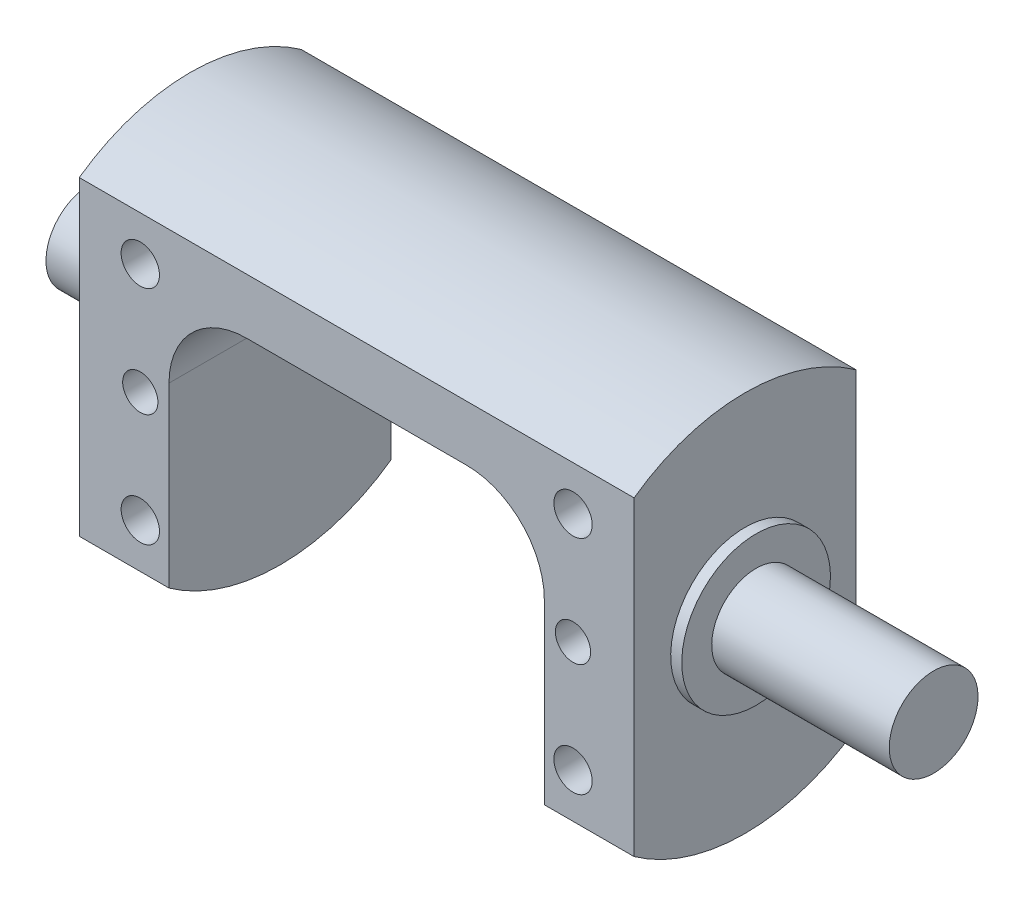
from build123d import *

# Parameters (mm, degrees)
CUT_EXTRUDE1_DEPTH                  = 72.281133549
CUT_EXTRUDE1_DEPTH_BACK             = 72.281133549
SKETCH3_OUTSIDE_W                   = 54.458
SKETCH3_OUTSIDE_H                   = 54.458
SKETCH3_OUTSIDE_W_2                 = 20
SKETCH3_OUTSIDE_H_2                 = 34.409301068
F_8_32_TAPPED_HOLE1_AT_2_COUNT      = 2
F_8_32_TAPPED_HOLE1_AT_2_PITCH      = 43.829214002
F_8_32_TAPPED_HOLE1_AT_3_COUNT      = 2
F_8_32_TAPPED_HOLE1_AT_3_PITCH      = 20
F_8_32_TAPPED_HOLE1_AT_4_COUNT      = 2
F_8_32_TAPPED_HOLE1_AT_4_PITCH      = 39
F_1_8_0_1250_DOWEL_HOLE1_AT_2_COUNT = 2
F_1_8_0_1250_DOWEL_HOLE1_AT_2_PITCH = 39
F_8_32_TAPPED_HOLE2_D               = 3.4544
F_8_32_TAPPED_HOLE2_DEPTH           = 10.71
F_8_32_TAPPED_HOLE2_TIP             = 1.037806461
CUT_EXTRUDE3_DEPTH                  = 50.598387071
CUT_EXTRUDE3_DEPTH_BACK             = 50.598387071


with BuildPart() as part:
    # Sketch2 → Revolve1 (revolve)
    with BuildSketch(Plane.XY, mode=Mode.PRIVATE) as revolve1_sk:
        Polygon((-34, 0), (42, 0), (42, 4), (26, 4), (26, 6.7), (25, 6.7), (25, 17.204650534), (-25, 17.204650534), (-25, 6.7), (-27.5, 6.7), (-27.5, 4), (-34, 4), align=None)
    revolve(revolve1_sk.sketch.rotate(Axis((-34, 0, 0), (1, 0, 0)), 180), axis=Axis((-34, 0, 0), (1, 0, 0)))

    # Sketch3 outside → Cut-Extrude1 (cut, two sides: drawn at the far end of the back side and taken through both)
    with BuildSketch(Plane.ZY.offset(25).offset(-CUT_EXTRUDE1_DEPTH_BACK)):
        Rectangle(SKETCH3_OUTSIDE_W, SKETCH3_OUTSIDE_H)
        Rectangle(SKETCH3_OUTSIDE_W_2, SKETCH3_OUTSIDE_H_2, mode=Mode.SUBTRACT)
    extrude(amount=CUT_EXTRUDE1_DEPTH + CUT_EXTRUDE1_DEPTH_BACK, mode=Mode.SUBTRACT)

    # Sketch5 → #8-32 Tapped Hole1 (revolve, cut)
    with BuildSketch(Plane(origin=(19.5, 10, -10), x_dir=(0, 1, 0), z_dir=(1, 0, 0))):
        Polygon((0, 0), (0, 11.747806461), (1.7272, 10.71), (1.7272, 0), align=None)
    f_8_32_tapped_hole1 = revolve(axis=Axis((19.5, 10, -16.35), (0, 0, 1)), mode=Mode.SUBTRACT)

    # #8-32 Tapped Hole1 at 2: #8-32 Tapped Hole1 ×2
    with Locations(*[Vector(-0.889817462812737, -0.4563166475962754, 0) * (i * F_8_32_TAPPED_HOLE1_AT_2_PITCH) for i in range(1, F_8_32_TAPPED_HOLE1_AT_2_COUNT)]):
        add(f_8_32_tapped_hole1, mode=Mode.SUBTRACT)

    # #8-32 Tapped Hole1 at 3: #8-32 Tapped Hole1 ×2
    with Locations(*[(0, -i * F_8_32_TAPPED_HOLE1_AT_3_PITCH, 0) for i in range(1, F_8_32_TAPPED_HOLE1_AT_3_COUNT)]):
        add(f_8_32_tapped_hole1, mode=Mode.SUBTRACT)

    # #8-32 Tapped Hole1 at 4: #8-32 Tapped Hole1 ×2
    with Locations(*[(-i * F_8_32_TAPPED_HOLE1_AT_4_PITCH, 0, 0) for i in range(1, F_8_32_TAPPED_HOLE1_AT_4_COUNT)]):
        add(f_8_32_tapped_hole1, mode=Mode.SUBTRACT)

    # Sketch7 → 1/8 (0.1250) Dowel Hole1 (revolve, cut)
    with BuildSketch(Plane(origin=(19.5, 0, -10), x_dir=(0, 1, 0), z_dir=(1, 0, 0))):
        Polygon((0, 0), (0, 6.953866233), (1.5875, 6), (1.5875, 0), align=None)
    f_1_8_0_1250_dowel_hole1 = revolve(axis=Axis((19.5, 0, -16.35), (0, 0, 1)), mode=Mode.SUBTRACT)

    # 1/8 (0.1250) Dowel Hole1 at 2: 1/8 (0.1250) Dowel Hole1 ×2
    with Locations(*[(-i * F_1_8_0_1250_DOWEL_HOLE1_AT_2_PITCH, 0, 0) for i in range(1, F_1_8_0_1250_DOWEL_HOLE1_AT_2_COUNT)]):
        add(f_1_8_0_1250_dowel_hole1, mode=Mode.SUBTRACT)

    # Mirror1: #8-32 Tapped Hole1, 1/8 (0.1250) Dowel Hole1 across plane
    add(f_8_32_tapped_hole1.mirror(Plane.XY), mode=Mode.SUBTRACT)
    add(f_1_8_0_1250_dowel_hole1.mirror(Plane.XY), mode=Mode.SUBTRACT)

    # Mirror1 copy 1 sketch → Mirror1 copy 1 (revolve, cut)
    with BuildSketch(Plane(origin=(-19.5, -10, 10), x_dir=(0, 1, 0), z_dir=(1, 0, 0))):
        Polygon((0, 0), (0, -11.747806461), (1.7272, -10.71), (1.7272, 0), align=None)
    revolve(axis=Axis((-19.5, -10, 16.35), (0, 0, 1)), mode=Mode.SUBTRACT)

    # Mirror1 copy 2 sketch → Mirror1 copy 2 (revolve, cut)
    with BuildSketch(Plane(origin=(19.5, -10, 10), x_dir=(0, 1, 0), z_dir=(1, 0, 0))):
        Polygon((0, 0), (0, -11.747806461), (1.7272, -10.71), (1.7272, 0), align=None)
    revolve(axis=Axis((19.5, -10, 16.35), (0, 0, 1)), mode=Mode.SUBTRACT)

    # Mirror1 copy 3 sketch → Mirror1 copy 3 (revolve, cut)
    with BuildSketch(Plane(origin=(-19.5, 10, 10), x_dir=(0, 1, 0), z_dir=(1, 0, 0))):
        Polygon((0, 0), (0, -11.747806461), (1.7272, -10.71), (1.7272, 0), align=None)
    revolve(axis=Axis((-19.5, 10, 16.35), (0, 0, 1)), mode=Mode.SUBTRACT)

    # Mirror1 copy 4 sketch → Mirror1 copy 4 (revolve, cut)
    with BuildSketch(Plane(origin=(-19.5, 0, 10), x_dir=(0, 1, 0), z_dir=(1, 0, 0))):
        Polygon((0, 0), (0, -6.953866233), (1.5875, -6), (1.5875, 0), align=None)
    revolve(axis=Axis((-19.5, 0, 16.35), (0, 0, 1)), mode=Mode.SUBTRACT)

    # #8-32 Tapped Hole2
    with Locations(Plane.ZY.offset(34)):
        with Locations((0, 0)):
            Hole(F_8_32_TAPPED_HOLE2_D / 2, depth=F_8_32_TAPPED_HOLE2_DEPTH)
            with Locations((0, 0, -(F_8_32_TAPPED_HOLE2_DEPTH + F_8_32_TAPPED_HOLE2_TIP / 2))):  # 118° drill point
                Cone(0, F_8_32_TAPPED_HOLE2_D / 2, F_8_32_TAPPED_HOLE2_TIP, mode=Mode.SUBTRACT)

    # Sketch12 → Cut-Extrude3 (cut, two sides: drawn at the far end of the back side and taken through both)
    with BuildSketch(Plane.XY.offset(10).offset(-CUT_EXTRUDE3_DEPTH_BACK)):
        with BuildLine():
            Line((-9.9125, -37.391646785), (9.9125, -37.391646785))
            ThreePointArc((9.9125, -37.391646785), (14.862247468, -35.341394253), (16.9125, -30.391646785))
            Line((16.9125, -30.391646785), (16.9125, 2))
            ThreePointArc((16.9125, 2), (14.862247468, 6.949747468), (9.9125, 9))
            Line((9.9125, 9), (-9.9125, 9))
            ThreePointArc((-9.9125, 9), (-14.862247468, 6.949747468), (-16.9125, 2))
            Line((-16.9125, 2), (-16.9125, -30.391646785))
            ThreePointArc((-16.9125, -30.391646785), (-14.862247468, -35.341394253), (-9.9125, -37.391646785))
        make_face()
    extrude(amount=CUT_EXTRUDE3_DEPTH + CUT_EXTRUDE3_DEPTH_BACK, mode=Mode.SUBTRACT)


solid = part.part
